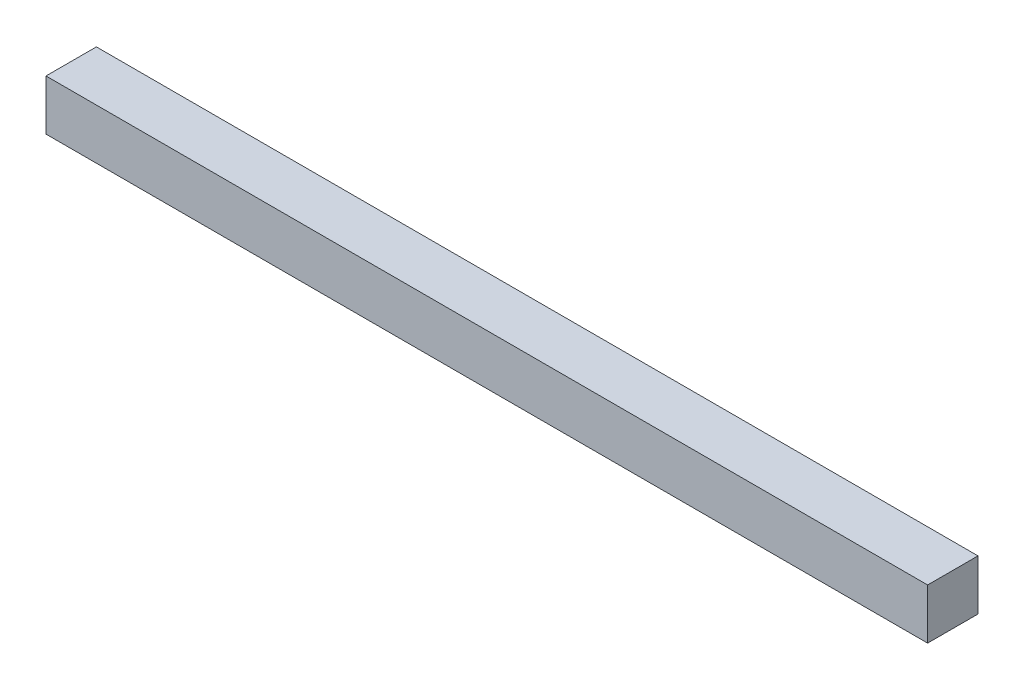
from build123d import *

# Parameters (mm, degrees)
SKETCH1_W           = 20
SKETCH1_H           = 20
BOSS_EXTRUDE1_DEPTH = 175


with BuildPart() as part:
    # Sketch1 → Boss-Extrude1 (new, symmetric)
    with BuildSketch(Plane(origin=(0, 0, 0), x_dir=(0, 0, -1), z_dir=(1, 0, 0))):
        Rectangle(SKETCH1_W, SKETCH1_H)
    extrude(amount=BOSS_EXTRUDE1_DEPTH, both=True)


solid = part.part
